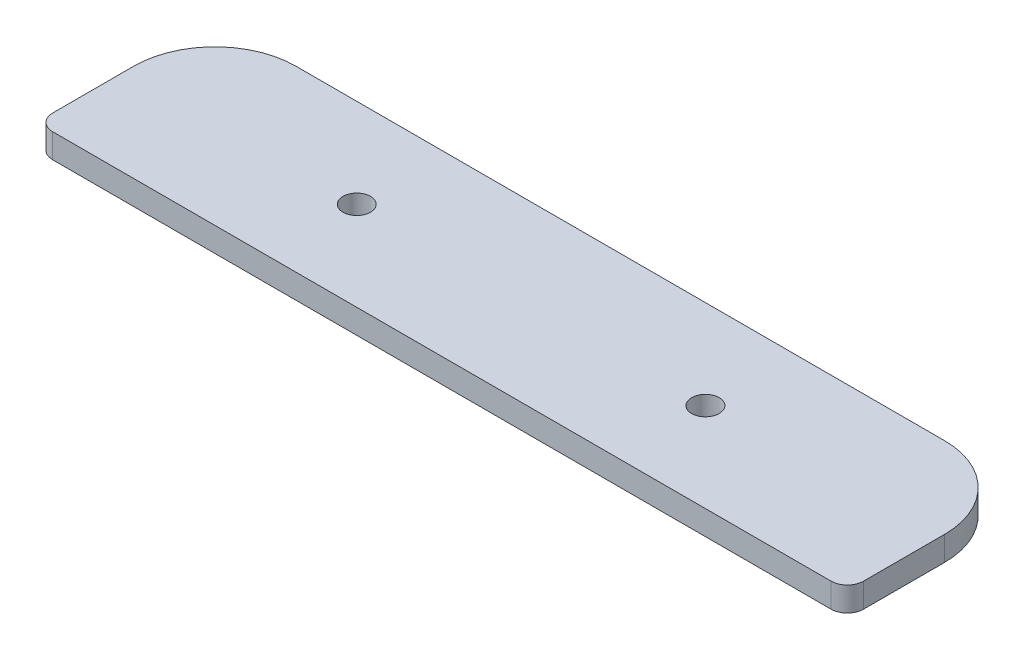
from build123d import *

# Parameters (mm, degrees)
SKETCH1_W           = 100
SKETCH1_H           = 22
BOSS_EXTRUDE1_DEPTH = 3
SKETCH2_R           = 1.7
CUT_EXTRUDE1_DEPTH  = 3
FILLET1_R           = 10
FILLET2_R           = 2


with BuildPart() as part:
    # Sketch1 → Boss-Extrude1 (new body)
    with BuildSketch(Plane(origin=(0, 12, 0), x_dir=(1, 0, 0), z_dir=(0, 1, 0))):
        with Locations((0, 39)):
            Rectangle(SKETCH1_W, SKETCH1_H)
    extrude(amount=BOSS_EXTRUDE1_DEPTH)

    # Sketch2 → Cut-Extrude1 (cut)
    with BuildSketch(Plane(origin=(0, 15, 0), x_dir=(1, 0, 0), z_dir=(0, 1, 0))):
        with Locations(Location((-21.5, 39, 0), (0, 0, 270))):
            Circle(SKETCH2_R)
        with Locations(Location((21.5, 39, 0), (0, 0, 270))):
            Circle(SKETCH2_R)
    extrude(amount=-CUT_EXTRUDE1_DEPTH, mode=Mode.SUBTRACT)

    # Fillet1
    fillet1_edges = [part.edges().sort_by_distance(p)[0] for p in [
        (-50, 13.5, -50),
        (50, 13.5, -50),
    ]]
    fillet(fillet1_edges, radius=FILLET1_R)

    # Fillet2
    fillet2_edges = [part.edges().sort_by_distance(p)[0] for p in [
        (50, 13.5, -28),
        (-50, 13.5, -28),
    ]]
    fillet(fillet2_edges, radius=FILLET2_R)


solid = part.part
